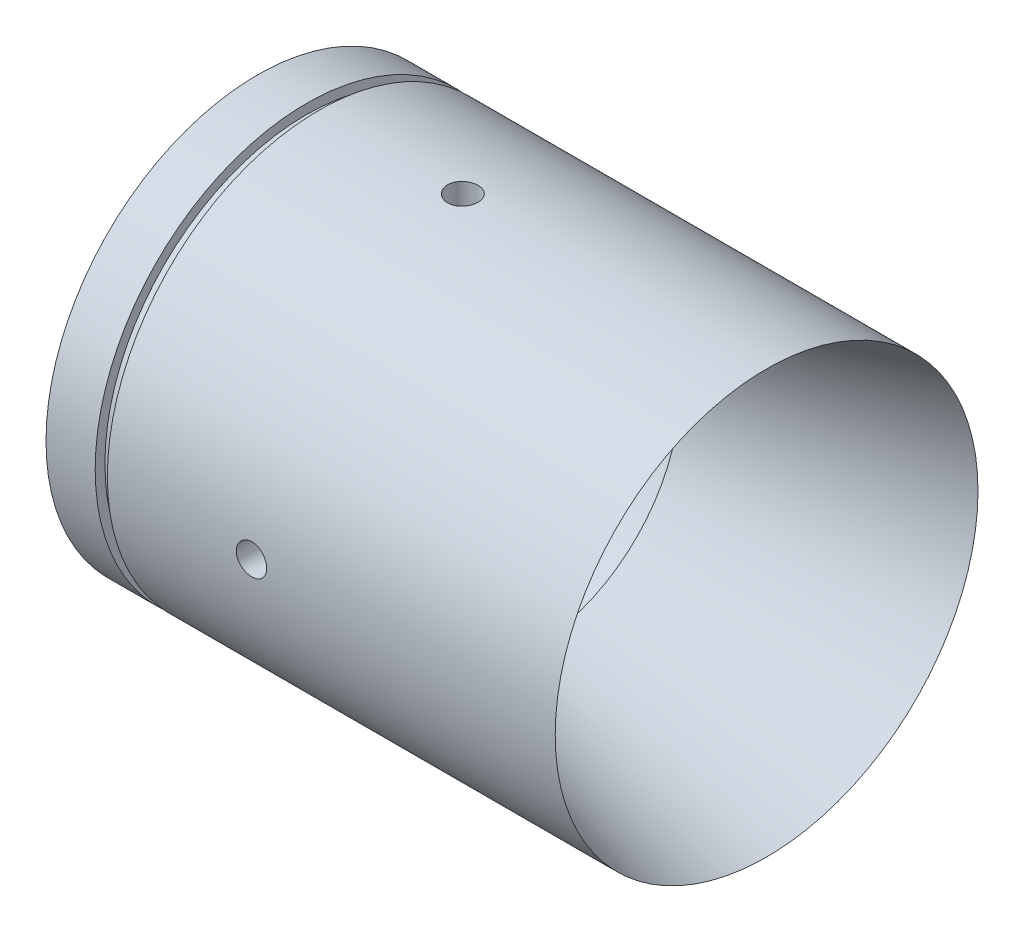
from build123d import *

# Parameters (mm, degrees)
SKETCH2_R          = 2.5
CUT_EXTRUDE1_DEPTH = 5
CIRPATTERN1_COUNT  = 4


with BuildPart() as part:
    # Sketch1 → Revolve1 (revolve)
    with BuildSketch(Plane.XY, mode=Mode.PRIVATE) as revolve1_sk:
        Polygon((11.626929507, 34.798), (19.723685425, 34.798), (19.723685425, 33.198), (21.723685425, 33.198), (21.723685425, 34.798), (95.442270017, 34.798), (56.73579947, 24.426632475), (56.73579947, 26.944570435), (29.496610327, 26.944570435), (11.626929507, 31.001470945), align=None)
    revolve(revolve1_sk.sketch.rotate(Axis((0, 0, 0), (1, 0, 0)), 90), axis=Axis((0, 0, 0), (1, 0, 0)))

    # Sketch2 → Cut-Extrude1 (cut)
    with BuildSketch(Plane(origin=(0, 34.798, 0), x_dir=(1, 0, 0), z_dir=(0, 1, 0))):
        with Locations(Location((45.442270017, 0, 0), (0, 0, 270))):
            Circle(SKETCH2_R)
    cut_extrude1 = extrude(amount=-CUT_EXTRUDE1_DEPTH, mode=Mode.SUBTRACT)

    # CirPattern1: Cut-Extrude1 ×4 about axis
    cirpattern1_axis = Axis((0, 0, 0), (1, 0, 0))
    for i in range(1, CIRPATTERN1_COUNT):
        add(cut_extrude1.rotate(cirpattern1_axis, i * 360 / CIRPATTERN1_COUNT), mode=Mode.SUBTRACT)


solid = part.part
